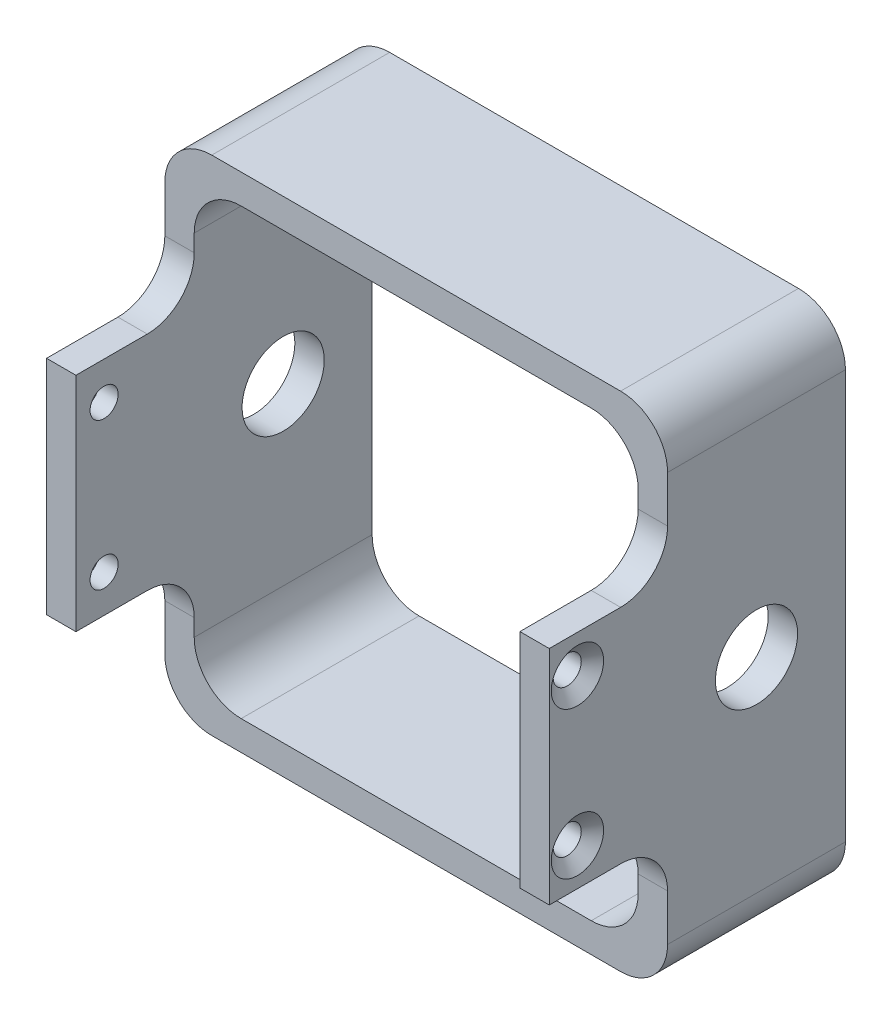
from build123d import *

# Parameters (mm, degrees)
SKETCH1_W                                 = 68.0085
SKETCH1_H                                 = 68.0085
SKETCH1_W_2                               = 60.0583
SKETCH1_H_2                               = 60.0583
BOSS_EXTRUDE1_DEPTH                       = 24.0665
F_7_16_0_4375_DIAMETER_HOLE1_D            = 11.1125
SKETCH10_W                                = 16.002
SKETCH10_H                                = 30.0482
BOSS_EXTRUDE2_DEPTH                       = 3.9751
FILLET1_R                                 = 6.35
FILLET1_OF_MIRROR1_R                      = 6.35
FILLET2_R                                 = 6.35
FILLET3_R                                 = 6.35
CSK_FOR_6_FLAT_HEAD_MACHINE_SCREW_2_COUNT = 2
CSK_FOR_6_FLAT_HEAD_MACHINE_SCREW_2_PITCH = 19.8882


with BuildPart() as part:
    # Sketch1 → Boss-Extrude1 (new body)
    with BuildSketch(Plane.XY):
        Rectangle(SKETCH1_W, SKETCH1_H)
        Rectangle(SKETCH1_W_2, SKETCH1_H_2, mode=Mode.SUBTRACT)
    extrude(amount=BOSS_EXTRUDE1_DEPTH)

    # 7/16 (0.4375) Diameter Hole1 (through all)
    with Locations(Plane(origin=(34.00425, 0, 0), x_dir=(0, 0, -1), z_dir=(1, 0, 0))):
        with Locations((-12.03325, 0)):
            Hole(F_7_16_0_4375_DIAMETER_HOLE1_D / 2)

    # Sketch10 → Boss-Extrude2 (add)
    with BuildSketch(Plane.ZY.offset(34.00425)):
        with Locations((32.0675, 0)):
            Rectangle(SKETCH10_W, SKETCH10_H)
    boss_extrude2 = extrude(amount=-BOSS_EXTRUDE2_DEPTH)

    # Fillet1
    fillet1_edges = [part.edges().sort_by_distance(p)[0] for p in [
        (-32.0167, -15.0241, 24.0665),
        (-32.0167, 15.0241, 24.0665),
    ]]
    fillet(fillet1_edges, radius=FILLET1_R)

    # Mirror1: Boss-Extrude2 across plane
    add(boss_extrude2.mirror(Plane(origin=(0, 0, 0), x_dir=(0, 0, 1), z_dir=(1, 0, 0))))

    # Fillet1 of Mirror1
    fillet1_of_mirror1_edges = [part.edges().sort_by_distance(p)[0] for p in [
        (32.0167, -15.0241, 24.0665),
        (32.0167, 15.0241, 24.0665),
    ]]
    fillet(fillet1_of_mirror1_edges, radius=FILLET1_OF_MIRROR1_R)

    # Fillet2
    fillet2_edges = [part.edges().sort_by_distance(p)[0] for p in [
        (34.00425, -34.00425, 12.03325),
        (-34.00425, -34.00425, 12.03325),
        (-34.00425, 34.00425, 12.03325),
        (34.00425, 34.00425, 12.03325),
    ]]
    fillet(fillet2_edges, radius=FILLET2_R)

    # Fillet3
    fillet3_edges = [part.edges().sort_by_distance(p)[0] for p in [
        (30.02915, -30.02915, 12.03325),
        (30.02915, 30.02915, 12.03325),
        (-30.02915, 30.02915, 12.03325),
        (-30.02915, -30.02915, 12.03325),
    ]]
    fillet(fillet3_edges, radius=FILLET3_R)

    # Sketch14 → CSK for #6 Flat Head Machine Screw (100)1 (revolve, cut)
    with BuildSketch(Plane(origin=(-34.00425, 9.9441, 36.2585), x_dir=(0, 0, 1), z_dir=(0, 1, 0))):
        Polygon((0, 0), (0, 10.538824014), (1.89865, 9.398), (1.89865, 1.380025208), (3.5433, 0), align=None)
    csk_for_6_flat_head_machine_screw_100 = revolve(axis=Axis((-40.35425, 9.9441, 36.2585), (1, 0, 0)), mode=Mode.SUBTRACT)

    # CSK for _6 Flat Head Machine Screw _ 2: CSK for #6 Flat Head Machine Screw (100)1 ×2
    with Locations(*[(0, -i * CSK_FOR_6_FLAT_HEAD_MACHINE_SCREW_2_PITCH, 0) for i in range(1, CSK_FOR_6_FLAT_HEAD_MACHINE_SCREW_2_COUNT)]):
        add(csk_for_6_flat_head_machine_screw_100, mode=Mode.SUBTRACT)

    # Mirror2: CSK for #6 Flat Head Machine Screw (100)1 across plane
    add(csk_for_6_flat_head_machine_screw_100.mirror(Plane(origin=(0, 0, 0), x_dir=(0, 0, 1), z_dir=(1, 0, 0))), mode=Mode.SUBTRACT)

    # Mirror2 copy 1 sketch → Mirror2 copy 1 (revolve, cut)
    with BuildSketch(Plane(origin=(34.00425, -9.9441, 36.2585), x_dir=(0, 0, 1), z_dir=(0, 1, 0))):
        Polygon((0, 0), (0, -10.538824014), (1.89865, -9.398), (1.89865, -1.380025208), (3.5433, 0), align=None)
    revolve(axis=Axis((40.35425, -9.9441, 36.2585), (1, 0, 0)), mode=Mode.SUBTRACT)


solid = part.part
